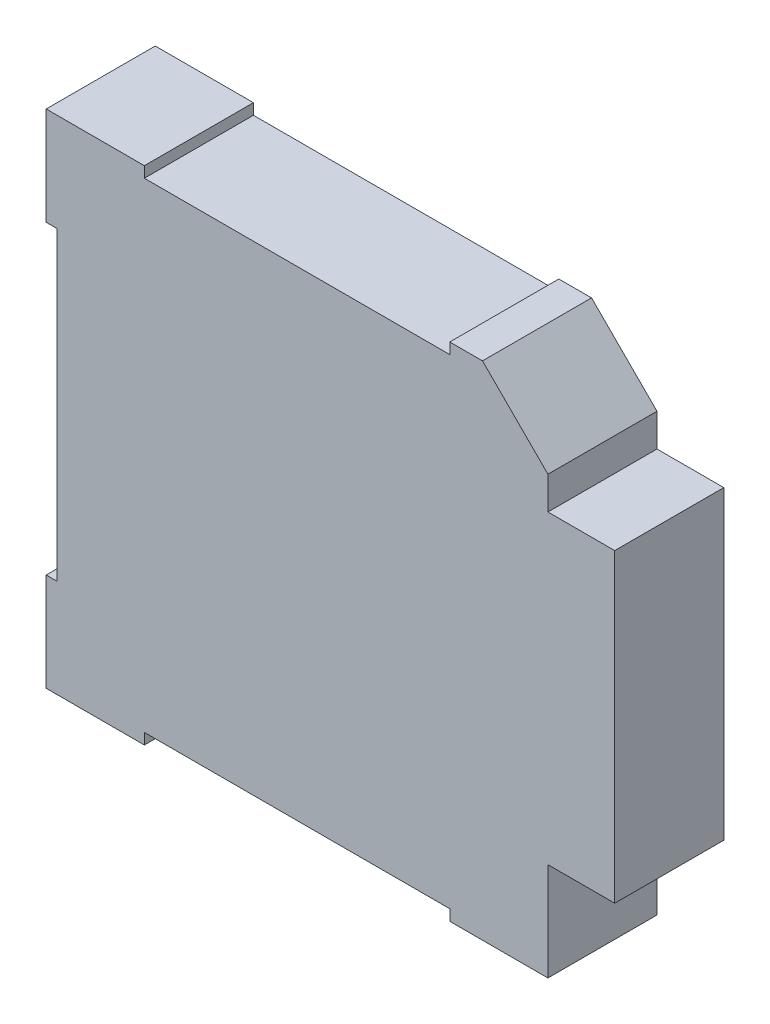
from build123d import *

# Parameters (mm, degrees)
COMPONENT_OUTLINE_DEPTH = 2


with BuildPart() as part:
    # 草图1 → Component_Outline (new body)
    with BuildSketch(Plane.XY):
        Polygon((4.6, -4.6), (4.6, -2.8), (5.825, -2.8), (5.825, 2.8), (4.6, 2.8), (4.6, 3.4), (3.4, 4.6), (2.8, 4.6), (2.8, 4.4), (-2.8, 4.4), (-2.8, 4.6), (-4.6, 4.6), (-4.6, 2.8), (-4.4, 2.8), (-4.4, -2.8), (-4.6, -2.8), (-4.6, -4.6), (-2.8, -4.6), (-2.8, -4.4), (2.8, -4.4), (2.8, -4.6), align=None)
    extrude(amount=COMPONENT_OUTLINE_DEPTH)


solid = part.part
